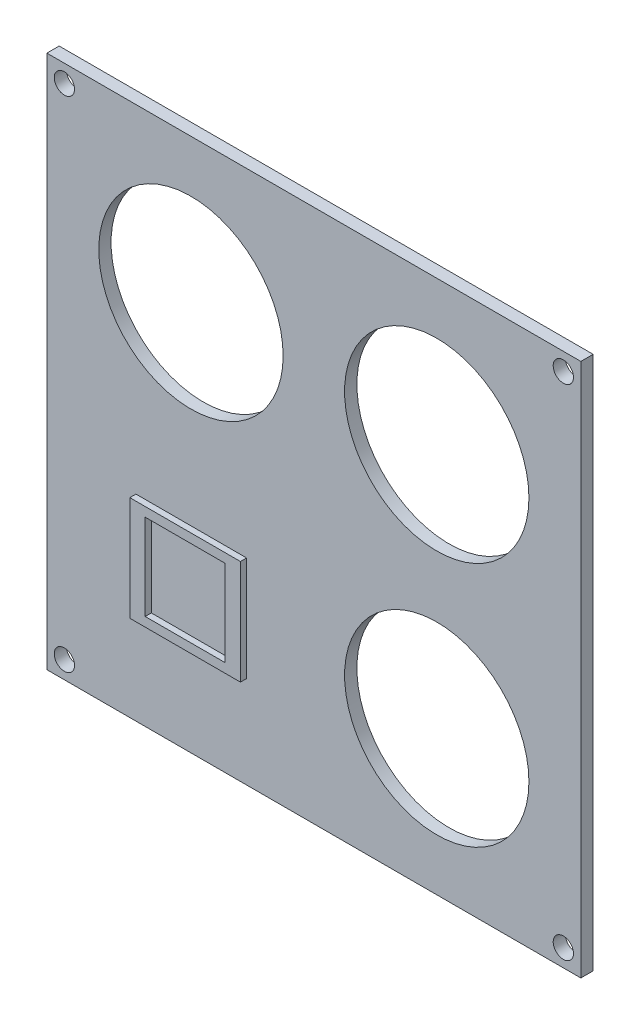
from build123d import *

# Parameters (mm, degrees)
SKETCH1_W           = 86.9
SKETCH1_H           = 86.9
BOSS_EXTRUDE1_DEPTH = 2
SKETCH2_R           = 1.65
CUT_EXTRUDE3_DEPTH  = 123.911431527
SKETCH3_W           = 18
SKETCH3_H           = 17
BOSS_EXTRUDE2_DEPTH = 1
SKETCH4_W           = 13
SKETCH4_H           = 14
CUT_EXTRUDE4_DEPTH  = 1
SKETCH5_R           = 15
CUT_EXTRUDE5_DEPTH  = 2


with BuildPart() as part:
    # Sketch1 → Boss-Extrude1 (new body)
    with BuildSketch(Plane(origin=(0, 0, 0), x_dir=(0, 1, 0), z_dir=(0, 0, 1))):
        with Locations((43.45, 43.45)):
            Rectangle(SKETCH1_W, SKETCH1_H)
    extrude(amount=BOSS_EXTRUDE1_DEPTH)

    # Sketch2 → Cut-Extrude3 (cut, through all)
    with BuildSketch(Plane.XY.offset(2)):
        with Locations((-84.05, 2.85)):
            Circle(SKETCH2_R)
        with Locations((-2.85, 2.85)):
            Circle(SKETCH2_R)
        with Locations((-2.85, 84.05)):
            Circle(SKETCH2_R)
        with Locations((-84.05, 84.05)):
            Circle(SKETCH2_R)
    extrude(amount=-CUT_EXTRUDE3_DEPTH, mode=Mode.SUBTRACT)

    # Sketch3 → Boss-Extrude2 (add)
    with BuildSketch(Plane.XY.offset(2)):
        with Locations((-63.4, 23.5)):
            Rectangle(SKETCH3_W, SKETCH3_H)
    extrude(amount=BOSS_EXTRUDE2_DEPTH)

    # Sketch4 → Cut-Extrude4 (cut)
    with BuildSketch(Plane.XY.offset(3)):
        with Locations((-63.4, 23.5)):
            Rectangle(SKETCH4_W, SKETCH4_H)
    extrude(amount=-CUT_EXTRUDE4_DEPTH, mode=Mode.SUBTRACT)

    # Sketch5 → Cut-Extrude5 (cut)
    with BuildSketch(Plane.XY.offset(2)):
        with Locations((-63.45, 63.45)):
            Circle(SKETCH5_R)
        with Locations((-23.45, 63.45)):
            Circle(SKETCH5_R)
        with Locations((-23.45, 23.45)):
            Circle(SKETCH5_R)
    extrude(amount=-CUT_EXTRUDE5_DEPTH, mode=Mode.SUBTRACT)


solid = part.part
